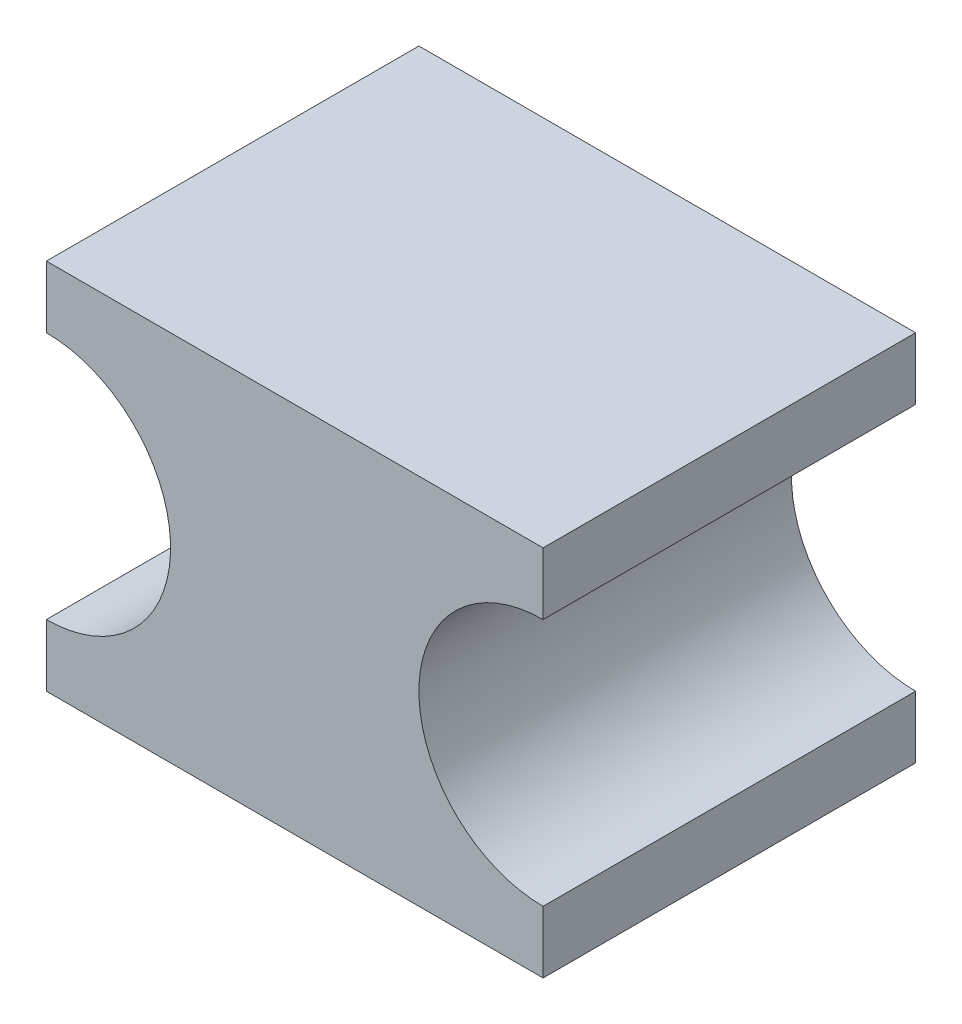
from build123d import *

# Parameters (mm, degrees)
SKETCH1_W           = 50.8
SKETCH1_H           = 38.1
BOSS_EXTRUDE1_DEPTH = 38.1
SKETCH2_R           = 12.7
CUT_EXTRUDE1_DEPTH  = 38.1


with BuildPart() as part:
    # Sketch1 → Boss-Extrude1 (new body)
    with BuildSketch(Plane(origin=(0, 0, 0), x_dir=(1, 0, 0), z_dir=(0, 1, 0))):
        with Locations((25.4, 19.05)):
            Rectangle(SKETCH1_W, SKETCH1_H)
    extrude(amount=BOSS_EXTRUDE1_DEPTH)

    # Sketch2 → Cut-Extrude1 (cut)
    with BuildSketch(Plane.XY):
        with Locations((0, 19.05)):
            Circle(SKETCH2_R)
        with Locations((50.8, 19.05)):
            Circle(SKETCH2_R)
    extrude(amount=-CUT_EXTRUDE1_DEPTH, mode=Mode.SUBTRACT)


solid = part.part
